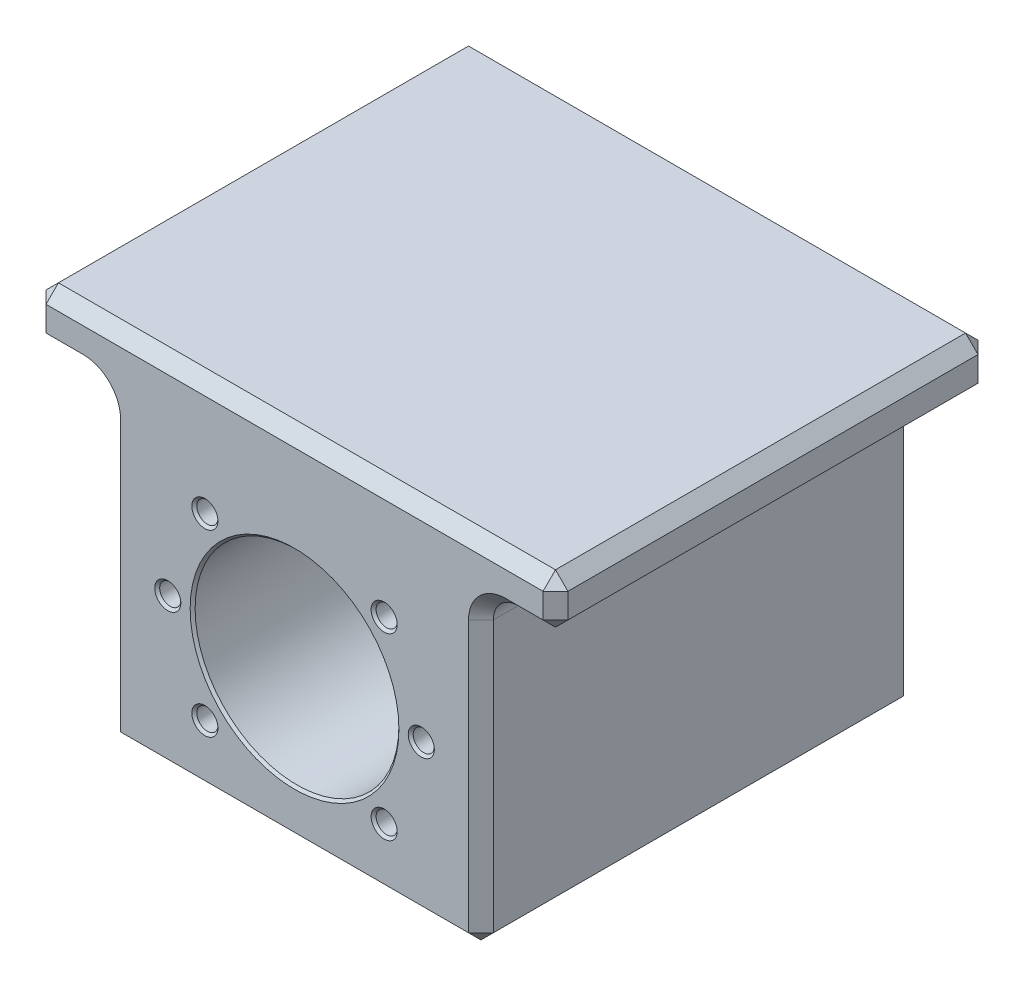
from build123d import *

# Parameters (mm, degrees)
SKETCH1_W                       = 150
SKETCH1_H                       = 124
BOSS_EXTRUDE1_DEPTH             = 87.5
BOSS_EXTRUDE2_REACH             = 132.863
SKETCH8_W                       = 210
SKETCH8_H                       = 20
BOSS_EXTRUDE2_DIRECTION_2_REACH = 132.863
CUT_EXTRUDE1_REACH              = 221.941
SKETCH2_R                       = 41
M10_TAPPED_HOLE1_D              = 8.5
M10_TAPPED_HOLE1_DEPTH          = 27.5
M10_TAPPED_HOLE1_TIP            = 2.553657631
FILLET1_R                       = 10
CHAMFER1_SIZE                   = 5
CHAMFER2_SIZE                   = 1


with BuildPart() as part:
    # Sketch1 → Boss-Extrude1 (new, symmetric)
    with BuildSketch(Plane.XY):
        Rectangle(SKETCH1_W, SKETCH1_H)
    extrude(amount=BOSS_EXTRUDE1_DEPTH, both=True)

    # Boss-Extrude2: up to this face of the body (flat: up to its plane)
    boss_extrude2_end = Plane(part.part.faces().sort_by_distance((0, 0, -87.5))[0])
    # Sketch8 → Boss-Extrude2 (add, up to the picked face)
    with BuildSketch(Plane.XY, mode=Mode.PRIVATE) as boss_extrude2_sk1:
        with Locations((0, 72)):
            Rectangle(SKETCH8_W, SKETCH8_H)
    boss_extrude2_tool1 = split(extrude(boss_extrude2_sk1.sketch, amount=-BOSS_EXTRUDE2_REACH, mode=Mode.PRIVATE), bisect_by=boss_extrude2_end, keep=Keep.BOTH, mode=Mode.PRIVATE)
    add(boss_extrude2_tool1.solids().sort_by(Axis((0, 72, 0), (0, 0, -1)))[0])

    # Boss-Extrude2 direction 2: up to this face of the body (flat: up to its plane)
    boss_extrude2_direction_2_end = Plane(part.part.faces().sort_by_distance((0, 0, 87.5))[0])
    # Sketch8 → Boss-Extrude2 direction 2 (add, up to the picked face)
    with BuildSketch(Plane.XY, mode=Mode.PRIVATE) as boss_extrude2_direction_2_sk1:
        with Locations((0, 72)):
            Rectangle(SKETCH8_W, SKETCH8_H)
    boss_extrude2_direction_2_tool1 = split(extrude(boss_extrude2_direction_2_sk1.sketch, amount=BOSS_EXTRUDE2_DIRECTION_2_REACH, mode=Mode.PRIVATE), bisect_by=boss_extrude2_direction_2_end, keep=Keep.BOTH, mode=Mode.PRIVATE)
    add(boss_extrude2_direction_2_tool1.solids().sort_by(Axis((0, 72, 0), (0, 0, 1)))[0])

    # Sketch2 → Cut-Extrude1 (cut, up to next)
    with BuildSketch(Plane.XY.offset(87.5), mode=Mode.PRIVATE) as cut_extrude1_sk1:
        Circle(SKETCH2_R)
    cut_extrude1_tool1 = extrude(cut_extrude1_sk1.sketch, amount=-CUT_EXTRUDE1_REACH, mode=Mode.PRIVATE) & part.part
    add(cut_extrude1_tool1.solids().sort_by_distance((0, 0, 87.5))[0], mode=Mode.SUBTRACT)

    # M10 Tapped Hole1
    with Locations(Plane.XY.offset(87.5)):
        with Locations((-36.062445841, -36.062445841), (-36.062445841, 36.062445841), (-51, 0), (36.062445841, 36.062445841), (51, 0), (36.062445841, -36.062445841)):
            Hole(M10_TAPPED_HOLE1_D / 2, depth=M10_TAPPED_HOLE1_DEPTH)
            with Locations((0, 0, -(M10_TAPPED_HOLE1_DEPTH + M10_TAPPED_HOLE1_TIP / 2))):  # 118° drill point
                Cone(0, M10_TAPPED_HOLE1_D / 2, M10_TAPPED_HOLE1_TIP, mode=Mode.SUBTRACT)

    # Fillet1
    fillet1_edges = [part.edges().sort_by_distance(p)[0] for p in [
        (-75, 62, 0),
        (75, 62, 0),
    ]]
    fillet(fillet1_edges, radius=FILLET1_R)

    # Chamfer1
    chamfer1_edges = [part.edges().sort_by_distance(p)[0] for p in [
        (-95, 62, -87.5),
        (95, 62, 87.5),
        (105, 62, 0),
        (105, 72, -87.5),
        (105, 82, 0),
        (105, 72, 87.5),
        (0, 82, -87.5),
        (-105, 82, 0),
        (0, 82, 87.5),
        (-105, 72, -87.5),
        (-105, 62, 0),
        (-105, 72, 87.5),
        (0, -62, 87.5),
        (75, -5, 87.5),
        (0, -62, -87.5),
        (75, -5, -87.5),
        (-75, -5, -87.5),
        (-75, -5, 87.5),
        (-95, 62, 87.5),
        (95, 62, -87.5),
        (-77.928932188, 59.071067812, -87.5),
        (-77.928932188, 59.071067812, 87.5),
        (77.928932188, 59.071067812, -87.5),
        (77.928932188, 59.071067812, 87.5),
        (75, -62, 0),
        (-75, -62, 0),
    ]]
    chamfer(chamfer1_edges, length=CHAMFER1_SIZE)

    # Chamfer2
    chamfer2_edges = [part.edges().sort_by_distance(p)[0] for p in [
        (-41, 0, -87.5),
        (-41, 0, 87.5),
        (-31.812445841, -36.062445841, 87.5),
        (-46.75, 0, 87.5),
        (-31.812445841, 36.062445841, 87.5),
        (40.312445841, -36.062445841, 87.5),
        (55.25, 0, 87.5),
        (40.312445841, 36.062445841, 87.5),
    ]]
    chamfer(chamfer2_edges, length=CHAMFER2_SIZE)


solid = part.part
